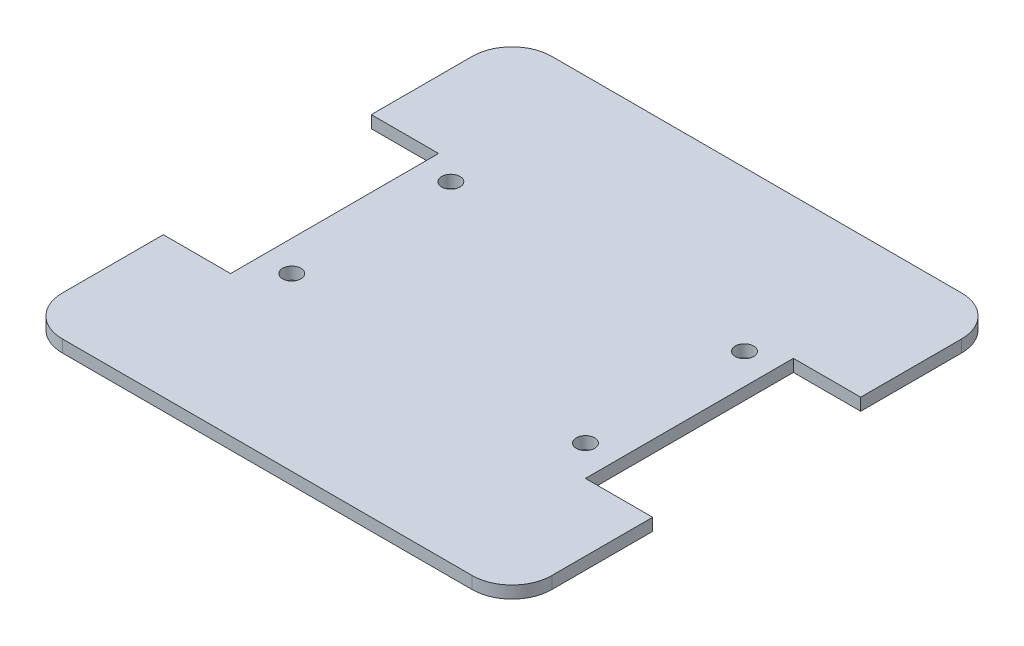
from build123d import *

# Parameters (mm, degrees)
SKETCH1_R           = 1.5
BOSS_EXTRUDE1_DEPTH = 2


with BuildPart() as part:
    # Sketch1 → Boss-Extrude1 (new body)
    with BuildSketch(Plane(origin=(0, 0, 0), x_dir=(1, 0, 0), z_dir=(0, 1, 0))):
        with BuildLine():
            Line((6.5, 0), (73.5, 0))
            ThreePointArc((73.5, 0), (78.096194078, 1.903805922), (80, 6.5))
            Line((80, 6.5), (80, 23))
            Line((80, 23), (69, 23))
            Line((69, 23), (69, 57))
            Line((69, 57), (80, 57))
            Line((80, 57), (80, 73.5))
            ThreePointArc((80, 73.5), (78.096194078, 78.096194078), (73.5, 80))
            Line((73.5, 80), (6.5, 80))
            ThreePointArc((6.5, 80), (1.903805922, 78.096194078), (0, 73.5))
            Line((0, 73.5), (0, 57))
            Line((0, 57), (11, 57))
            Line((11, 57), (11, 23))
            Line((11, 23), (0, 23))
            Line((0, 23), (0, 6.5))
            ThreePointArc((0, 6.5), (1.903805922, 1.903805922), (6.5, 0))
        make_face()
        with Locations(Location((16, 54, 0), (0, 0, 270))):
            Circle(SKETCH1_R, mode=Mode.SUBTRACT)
        with Locations(Location((16, 28, 0), (0, 0, 270))):
            Circle(SKETCH1_R, mode=Mode.SUBTRACT)
        with Locations(Location((64, 28, 0), (0, 0, 90))):
            Circle(SKETCH1_R, mode=Mode.SUBTRACT)
        with Locations(Location((64, 54, 0), (0, 0, 90))):
            Circle(SKETCH1_R, mode=Mode.SUBTRACT)
    extrude(amount=BOSS_EXTRUDE1_DEPTH)


solid = part.part
